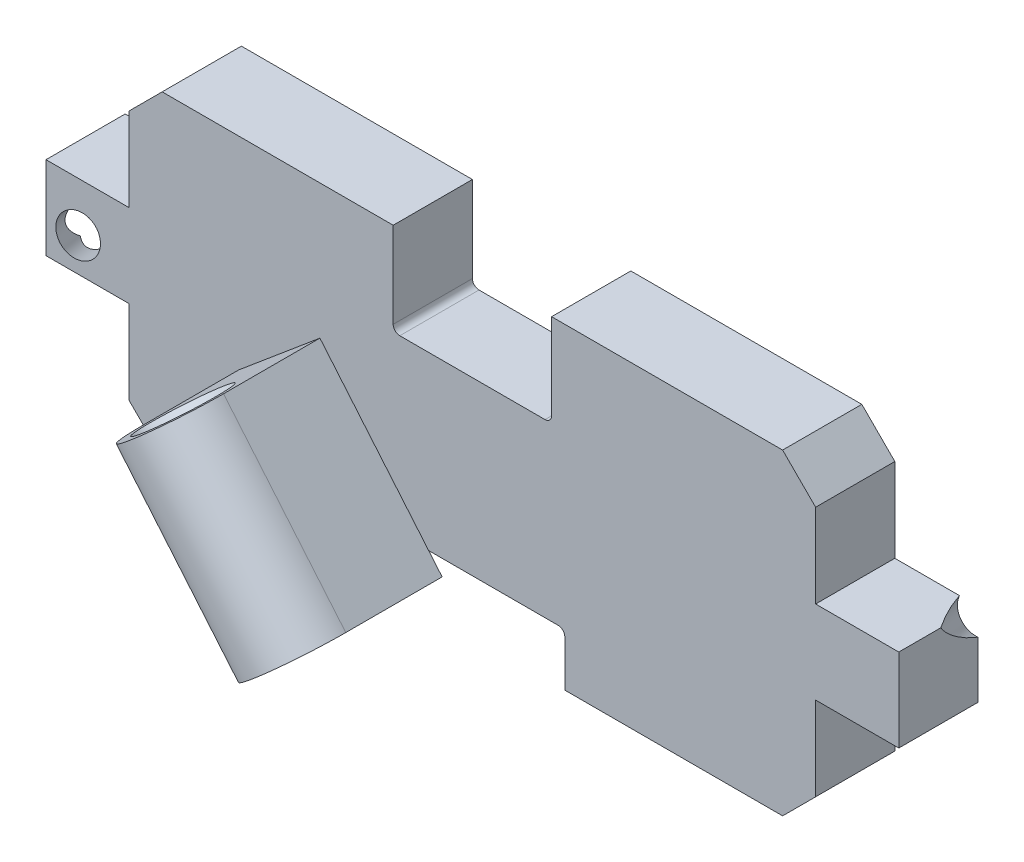
from build123d import *
from build123d.topology import SkipClean

# Parameters (mm, degrees)
BOSS_EXTRUDE1_START           = 5
BOSS_EXTRUDE1_DEPTH           = 6
CHAMFER1_SIZE                 = 4.5
SKETCH2_W                     = 6
SKETCH2_H                     = 6.3
BOSS_EXTRUDE2_DEPTH           = 6.3
BOSS_EXTRUDE3_DEPTH           = 7.3
BOSS_EXTRUDE4_DEPTH           = 14.405295
CSK_FOR_M3_SFHCS1_D           = 3
CSK_FOR_M3_SFHCS1_CSINK_D     = 6.3
CSK_FOR_M3_SFHCS1_CSINK_ANGLE = 90
BOSS_EXTRUDE5_DEPTH           = 14.405295
CSK_FOR_M3_SFHCS2_D           = 3
CSK_FOR_M3_SFHCS2_CSINK_D     = 6.3
CSK_FOR_M3_SFHCS2_CSINK_ANGLE = 90
SKETCH10_W                    = 19.443915682
SKETCH10_H                    = 19.443915683
CUT_EXTRUDE1_DEPTH            = 15
CSK_FOR_M3_SFHCS3_D           = 3
CSK_FOR_M3_SFHCS3_DEPTH       = 96.77876722
CSK_FOR_M3_SFHCS3_CSINK_D     = 6.3
CSK_FOR_M3_SFHCS3_CSINK_ANGLE = 90


with BuildPart() as part:
    # Sketch1 → Boss-Extrude1 (new body)
    with BuildSketch(Plane.XY.offset(BOSS_EXTRUDE1_START)):
        with BuildLine():
            Line((-23.5, -12), (-7, -12))
            Line((-7, -12), (-7, -8.5))
            ThreePointArc((-7, -8.5), (-6.853553391, -8.146446609), (-6.5, -8))
            Line((-6.5, -8), (6.5, -8))
            ThreePointArc((6.5, -8), (6.853553391, -8.146446609), (7, -8.5))
            Line((7, -8.5), (7, -12))
            Line((7, -12), (23.5, -12))
            Line((23.5, -12), (26, -9.5))
            Line((26, -9.5), (26, -3.15))
            Line((26, -3.15), (32.3, -3.15))
            Line((32.3, -3.15), (32.3, 3.15))
            Line((32.3, 3.15), (26, 3.15))
            Line((26, 3.15), (26, 9.5))
            Line((26, 9.5), (23.5, 12))
            Line((23.5, 12), (6, 12))
            Line((6, 12), (6, 5.5))
            ThreePointArc((6, 5.5), (5.853553391, 5.146446609), (5.5, 5))
            Line((5.5, 5), (-5.5, 5))
            ThreePointArc((-5.5, 5), (-5.853553391, 5.146446609), (-6, 5.5))
            Line((-6, 5.5), (-6, 12))
            Line((-6, 12), (-23.5, 12))
            Line((-23.5, 12), (-26, 9.5))
            Line((-26, 9.5), (-26, 3.15))
            Line((-26, 3.15), (-32.3, 3.15))
            Line((-32.3, 3.15), (-32.3, -3.15))
            Line((-32.3, -3.15), (-26, -3.15))
            Line((-26, -3.15), (-26, -9.5))
            Line((-26, -9.5), (-23.5, -12))
        make_face()
    extrude(amount=BOSS_EXTRUDE1_DEPTH)

    # Chamfer1
    chamfer1_edges = [part.edges().sort_by_distance(p)[0] for p in [
        (7, -10.25, 5),
        (6.853553391, -8.146446609, 5),
        (0, -8, 5),
        (-6.853553391, -8.146446609, 5),
        (-7, -10.25, 5),
    ]]
    chamfer(chamfer1_edges, length=CHAMFER1_SIZE)

    # Sketch2 → Boss-Extrude2 (add)
    with BuildSketch(Plane(origin=(26, 0, 0), x_dir=(0, 0, -1), z_dir=(1, 0, 0))):
        with Locations((-8, 0)):
            Rectangle(SKETCH2_W, SKETCH2_H)
    boss_extrude2 = extrude(amount=BOSS_EXTRUDE2_DEPTH)

    # Mirror1: Boss-Extrude2 across plane
    add(boss_extrude2.mirror(Plane(origin=(0, 0, 0), x_dir=(0, 0, 1), z_dir=(1, 0, 0))))

    # Sketch3 → Boss-Extrude3 (add)
    with BuildSketch(Plane.XY.offset(11)):
        Polygon((11.551404138, 1.816830905), (2.291859281, -9.218264944), (8.439052056, -14.376372134), (17.698596913, -3.341276285), align=None)
    boss_extrude3 = extrude(amount=BOSS_EXTRUDE3_DEPTH)

    # Sketch4 → Boss-Extrude4 (add)
    with SkipClean():  # the faces are left unmerged after this step: merging them gives an invalid solid
        with BuildSketch(Plane(origin=(5.667376511, 6.754116317, 0), x_dir=(0.7660444431189792, -0.6427876096865379, 0), z_dir=(0.6427876096865379, 0.7660444431189792, 0))):
            with BuildLine():
                Line((15.705642813, -18.3), (7.681052555, -18.3))
                ThreePointArc((7.681052555, -18.3), (11.693347684, -22.312295129), (15.705642813, -18.3))
            make_face()
        extrude(amount=-BOSS_EXTRUDE4_DEPTH)

    # CSK for M3 SFHCS1 (through all)
    with Locations(Plane(origin=(5.667376511, 6.754116317, 0), x_dir=(0.7660444431189792, -0.6427876096865379, 0), z_dir=(0.6427876096865379, 0.7660444431189792, 0))):
        with Locations((11.693347684, -18.3)):
            CounterSinkHole(CSK_FOR_M3_SFHCS1_D / 2, CSK_FOR_M3_SFHCS1_CSINK_D / 2, counter_sink_angle=CSK_FOR_M3_SFHCS1_CSINK_ANGLE)

    # Mirror11: Boss-Extrude3 across plane
    with SkipClean():  # the faces are left unmerged after this step: merging them gives an invalid solid
        add(boss_extrude3.mirror(Plane(origin=(0, 0, 0), x_dir=(0, 0, 1), z_dir=(1, 0, 0))))

    # Sketch7 → Boss-Extrude5 (add)
    with SkipClean():  # the faces are left unmerged after this step: merging them gives an invalid solid
        with BuildSketch(Plane(origin=(-5.667376511, 6.754116317, 0), x_dir=(0.7660444431189792, 0.6427876096865379, 0), z_dir=(-0.6427876096865379, 0.7660444431189792, 0))):
            with BuildLine():
                Line((-15.705642813, -18.3), (-7.681052555, -18.3))
                ThreePointArc((-7.681052555, -18.3), (-11.693347684, -22.312295129), (-15.705642813, -18.3))
            make_face()
        extrude(amount=-BOSS_EXTRUDE5_DEPTH)

    # CSK for M3 SFHCS2 (through all)
    with Locations(Plane(origin=(-5.667376511, 6.754116317, 0), x_dir=(0.7660444431189792, 0.6427876096865379, 0), z_dir=(-0.6427876096865379, 0.7660444431189792, 0))):
        with Locations((-11.693347684, -18.3)):
            CounterSinkHole(CSK_FOR_M3_SFHCS2_D / 2, CSK_FOR_M3_SFHCS2_CSINK_D / 2, counter_sink_angle=CSK_FOR_M3_SFHCS2_CSINK_ANGLE)

    # Sketch10 → Cut-Extrude1 (cut)
    with SkipClean():  # the faces are left unmerged after this step: merging them gives an invalid solid
        with BuildSketch(Plane.XY.offset(11)):
            with Locations((9.721957841, -5.898825434)):
                Rectangle(SKETCH10_W, SKETCH10_H)
        extrude(amount=CUT_EXTRUDE1_DEPTH, mode=Mode.SUBTRACT)

    # CSK for M3 SFHCS3
    with Locations(Plane(origin=(1373.834887972, -105.616816862, -567.783106147), x_dir=(0.6343091461006831, 0.5322485705454647, -0.5606811628058603), z_dir=(0.4295066891289175, 0.36039890443624706, 0.8280317830099689))):
        with Locations((-1114.335057549, 945.253960578), (-1158.995448583, 982.728478223)):
            CounterSinkHole(CSK_FOR_M3_SFHCS3_D / 2, CSK_FOR_M3_SFHCS3_CSINK_D / 2, depth=CSK_FOR_M3_SFHCS3_DEPTH, counter_sink_angle=CSK_FOR_M3_SFHCS3_CSINK_ANGLE)


solid = part.part
